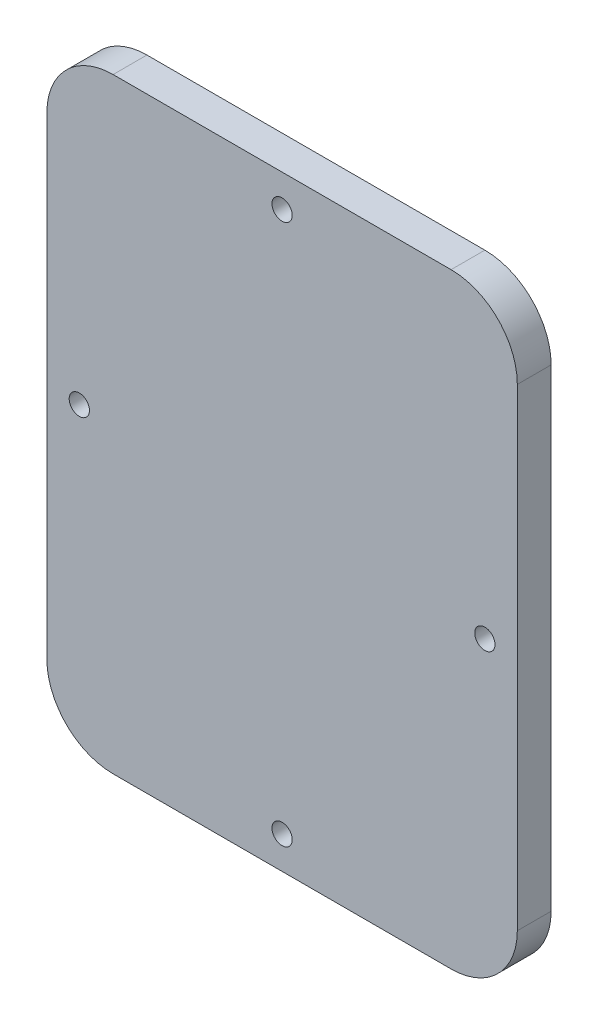
from build123d import *

# Parameters (mm, degrees)
ESBO_O1_R                = 1.5
RESSALTO_EXTRUS_O1_DEPTH = 5


with BuildPart() as part:
    # Esboço1 → Ressalto-extrusão1 (new body)
    with BuildSketch(Plane.XY):
        with BuildLine():
            Line((34.8, -35), (34.8, 35))
            ThreePointArc((34.8, 35), (31.929646456, 41.929646456), (25, 44.8))
            Line((25, 44.8), (-25, 44.8))
            ThreePointArc((-25, 44.8), (-31.929646456, 41.929646456), (-34.8, 35))
            Line((-34.8, 35), (-34.8, -35))
            ThreePointArc((-34.8, -35), (-31.929646456, -41.929646456), (-25, -44.8))
            Line((-25, -44.8), (25, -44.8))
            ThreePointArc((25, -44.8), (31.929646456, -41.929646456), (34.8, -35))
        make_face()
        with Locations((30, 0)):
            Circle(ESBO_O1_R, mode=Mode.SUBTRACT)
        with Locations((-30, 0)):
            Circle(ESBO_O1_R, mode=Mode.SUBTRACT)
        with Locations((0, 40)):
            Circle(ESBO_O1_R, mode=Mode.SUBTRACT)
        with Locations((0, -40)):
            Circle(ESBO_O1_R, mode=Mode.SUBTRACT)
    extrude(amount=RESSALTO_EXTRUS_O1_DEPTH)


solid = part.part
